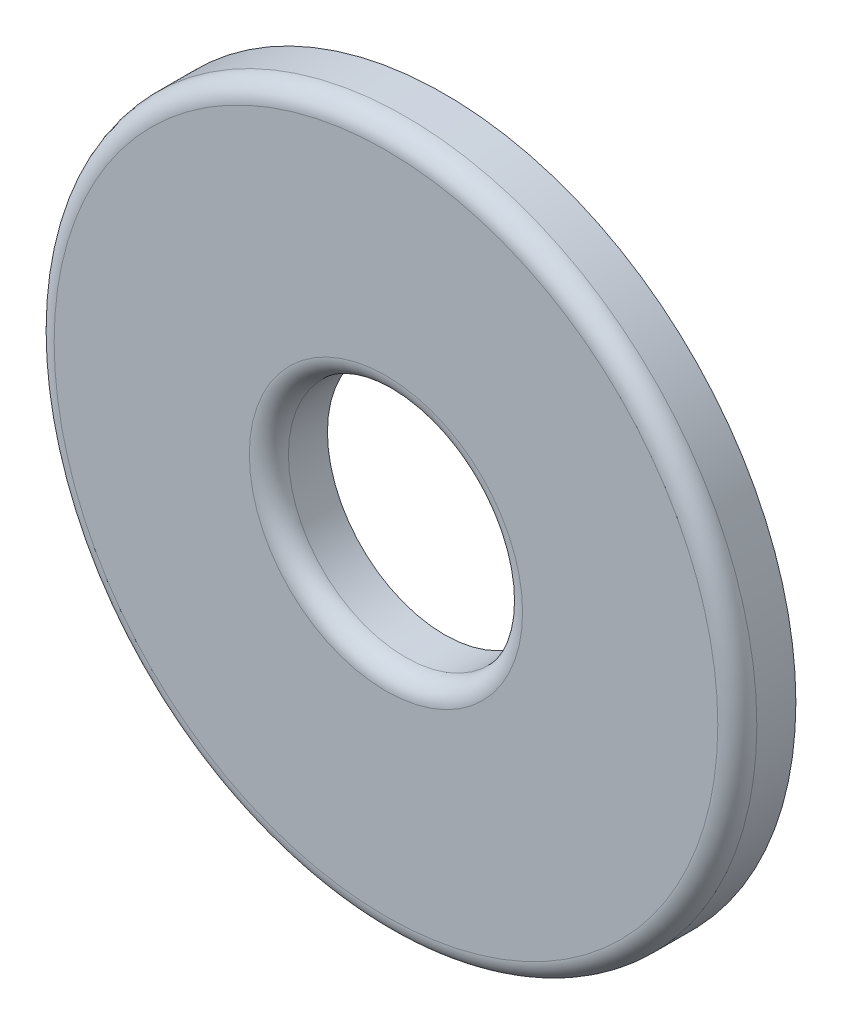
from build123d import *

# Parameters (mm, degrees)
SKETCH1_R           = 4.5
SKETCH1_R_2         = 1.5
BOSS_EXTRUDE1_DEPTH = 0.75
FILLET1_R           = 0.25


with BuildPart() as part:
    # Sketch1 → Boss-Extrude1 (new body)
    with BuildSketch(Plane.XY):
        Circle(SKETCH1_R)
        Circle(SKETCH1_R_2, mode=Mode.SUBTRACT)
    extrude(amount=BOSS_EXTRUDE1_DEPTH)

    # Fillet1
    fillet1_edges = [part.edges().sort_by_distance(p)[0] for p in [
        (-4.5, 0, 0.75),
        (-1.5, 0, 0.75),
    ]]
    fillet(fillet1_edges, radius=FILLET1_R)


solid = part.part
